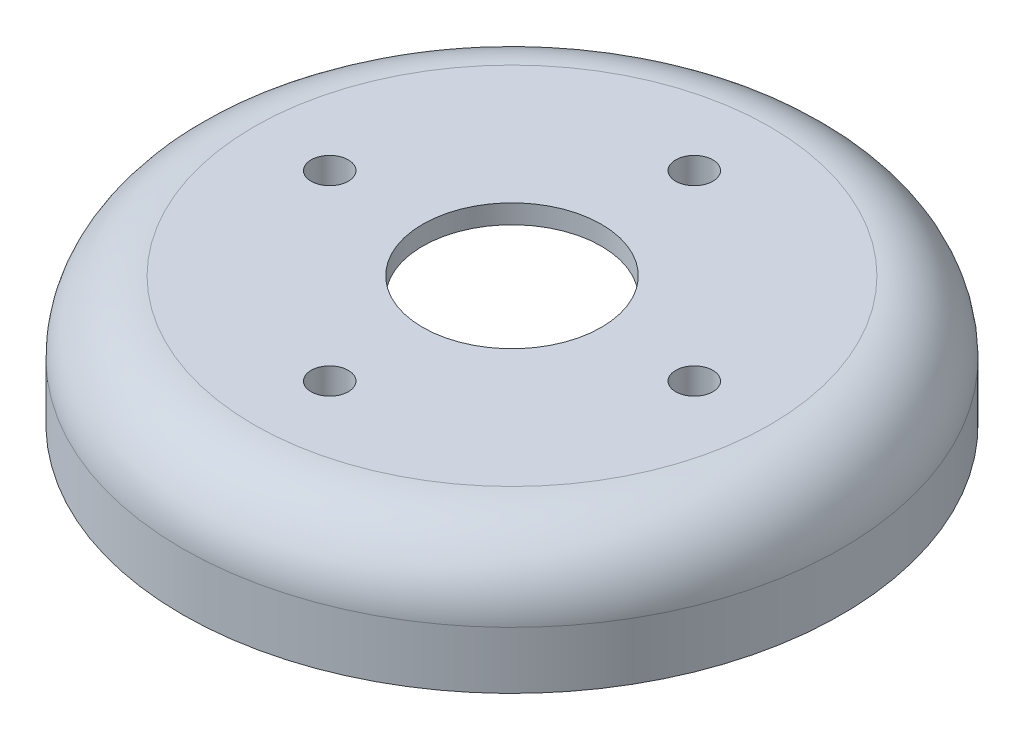
from build123d import *

# Parameters (mm, degrees)
SKETCH2_R          = 2.6
SKETCH2_R_2        = 12.5
CUT_EXTRUDE1_DEPTH = 79.098783601
FILLET1_R          = 10


with BuildPart() as part:
    # Sketch1 → Revolve1 (revolve)
    with BuildSketch(Plane.XY, mode=Mode.PRIVATE) as revolve1_sk:
        with BuildLine():
            Line((0, 41), (0, 43))
            Line((0, 43), (46.1, 43))
            Line((46.1, 43), (46.1, 25))
            Line((46.1, 25), (44.1, 25))
            add(Edge.make_bspline(
                [(44.1, 25), (44.1, 41), (0, 41)],
                knots=[0, 0, 0, 1.570796327, 1.570796327, 1.570796327], degree=2, weights=[1, 0.707106781, 1]))
        make_face()
    revolve(revolve1_sk.sketch.rotate(Axis((0, 41, 0), (0, 1, 0)), 90), axis=Axis((0, 41, 0), (0, 1, 0)))

    # Sketch2 → Cut-Extrude1 (cut, through all)
    with BuildSketch(Plane(origin=(0, 0, 0), x_dir=(1, 0, 0), z_dir=(0, 1, 0))):
        with Locations(Location((25.5, 0, 0), (0, 0, 180))):
            Circle(SKETCH2_R)
        with Locations(Location((0, -25.5, 0), (0, 0, 90))):
            Circle(SKETCH2_R)
        with Locations(Location((-25.5, 0, 0), (0, 0, 90))):
            Circle(SKETCH2_R)
        with Locations(Location((0, 25.5, 0), (0, 0, 270))):
            Circle(SKETCH2_R)
        with Locations(Location((0, 0, 0), (0, 0, 90))):
            Circle(SKETCH2_R_2)
    extrude(amount=CUT_EXTRUDE1_DEPTH, mode=Mode.SUBTRACT)

    # Fillet1
    fillet1_edges = [part.edges().sort_by_distance(p)[0] for p in [
        (0, 43, 46.1),
    ]]
    fillet(fillet1_edges, radius=FILLET1_R)


solid = part.part
